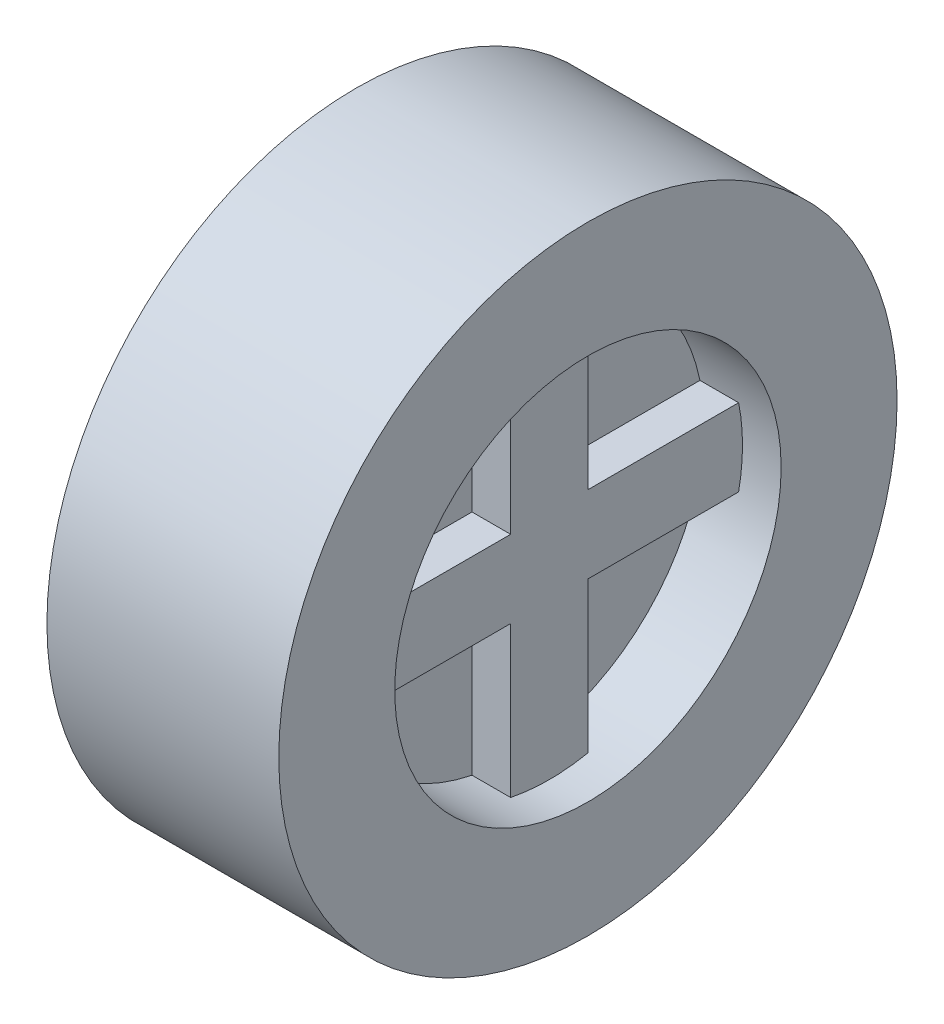
from build123d import *

# Parameters (mm, degrees)
SKETCH_1_R          = 4
EXTRUDE_1_DEPTH     = 3
SKETCH_2_R          = 2.5
CUT_EXTRUDE_1_DEPTH = 1
CUT_EXTRUDE_START   = -1
SKETCH_3_R          = 2.5
CUT_EXTRUDE_2_DEPTH = 1
EXTRUDE_START       = 0.5
EXTRUDE_2_DEPTH     = 0.5


with BuildPart() as part:
    # 草图1 → 凸台-拉伸1 (new body)
    with BuildSketch(Plane(origin=(0, 0, 0), x_dir=(0, 0, -1), z_dir=(1, 0, 0))):
        Circle(SKETCH_1_R)
    extrude(amount=EXTRUDE_1_DEPTH)

    # 草图2 → 切除-拉伸1 (cut)
    with BuildSketch(Plane(origin=(3, 0, 0), x_dir=(0, 0, -1), z_dir=(1, 0, 0))):
        Circle(SKETCH_2_R)
    extrude(amount=-CUT_EXTRUDE_1_DEPTH, mode=Mode.SUBTRACT)

    # 草图3 → 切除-拉伸2 (cut)
    with BuildSketch(Plane.ZY.offset(CUT_EXTRUDE_START)):
        with Locations(Location((0, 0, 0), (0, 0, 180))):
            Circle(SKETCH_3_R)
    extrude(amount=CUT_EXTRUDE_2_DEPTH, mode=Mode.SUBTRACT)

    # 草图4 → 凸台-拉伸2 (add)
    with BuildSketch(Plane(origin=(2, 0, 0), x_dir=(0, 0, -1), z_dir=(1, 0, 0)).offset(EXTRUDE_START)):
        with BuildLine():
            Line((-0.5, -0.5), (-0.5, -2.449489743))
            ThreePointArc((-0.5, -2.449489743), (0, -2.5), (0.5, -2.449489743))
            Line((0.5, -2.449489743), (0.5, -0.5))
            Line((0.5, -0.5), (2.449489743, -0.5))
            ThreePointArc((2.449489743, -0.5), (2.5, 0), (2.449489743, 0.5))
            Line((2.449489743, 0.5), (0.5, 0.5))
            Line((0.5, 0.5), (0.5, 2.449489743))
            ThreePointArc((0.5, 2.449489743), (0, 2.5), (-0.5, 2.449489743))
            Line((-0.5, 2.449489743), (-0.5, 0.5))
            Line((-0.5, 0.5), (-2.449489743, 0.5))
            ThreePointArc((-2.449489743, 0.5), (-2.5, 0), (-2.449489743, -0.5))
            Line((-2.449489743, -0.5), (-0.5, -0.5))
        make_face()
    extrude(amount=-EXTRUDE_2_DEPTH)


solid = part.part
